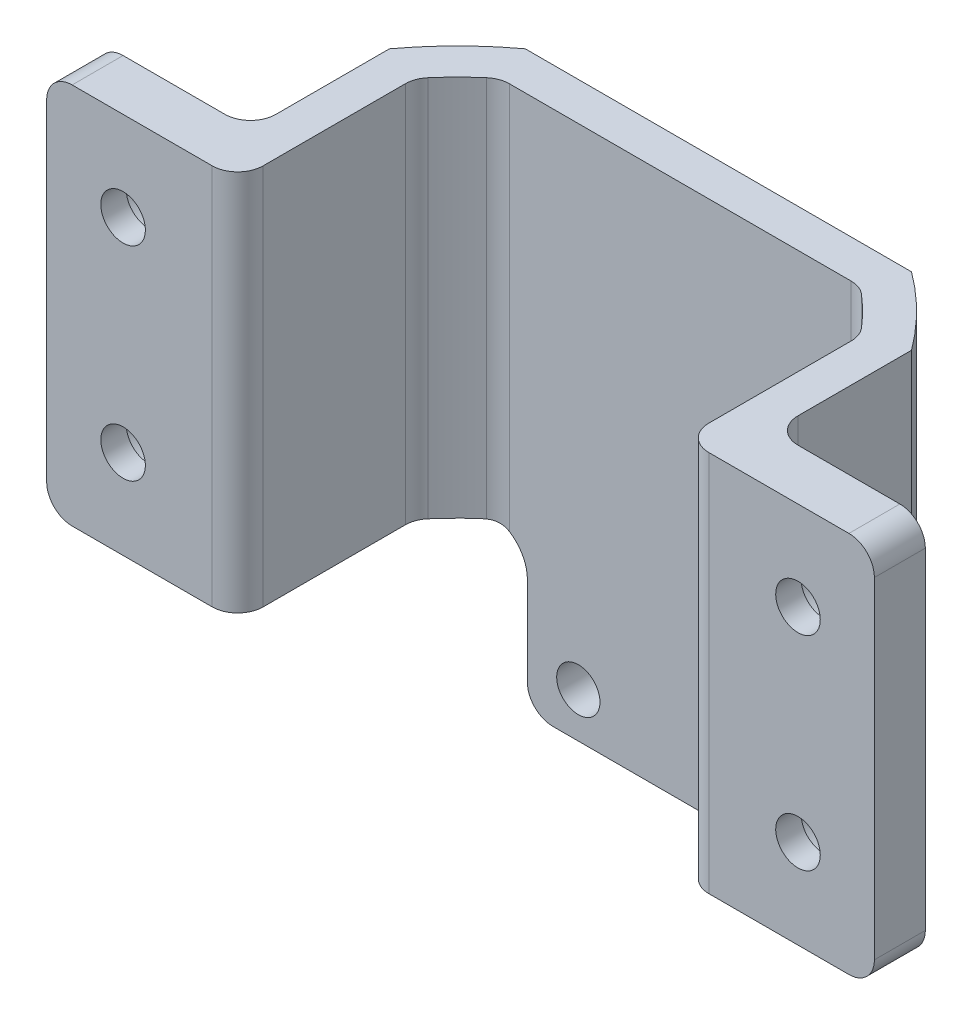
from build123d import *

# Parameters (mm, degrees)
EXTRUDE_1_DEPTH     = 30
FILLET_1_R          = 2
SKETCH_2_W          = 4
SKETCH_2_H          = 30
EXTRUDE_2_DEPTH     = 12
SKETCH_3_W          = 79.384571865
SKETCH_3_H          = 60.739492306
CUT_EXTRUDE_1_DEPTH = 30
SKETCH_4_R          = 1.75
CUT_EXTRUDE_2_DEPTH = 30
SKETCH_5_R          = 3
CUT_EXTRUDE_3_DEPTH = 2
FILLET_2_R          = 2
SKETCH_6_W          = 24
SKETCH_6_H          = 3
EXTRUDE_4_DEPTH     = 12
SKETCH_7_R          = 1.7
CUT_EXTRUDE_4_DEPTH = 12
FILLET_3_R          = 3
FILLET_4_R          = 2


with BuildPart() as part:
    # 草图1 → 凸台-拉伸1 (new body)
    with BuildSketch(Plane(origin=(0, 0, 0), x_dir=(1, 0, 0), z_dir=(0, 1, 0))):
        with BuildLine():
            Line((15.165750888, 20.5), (-15.165750888, 20.5))
            ThreePointArc((-15.165750888, 20.5), (-18.03122292, 18.03122292), (-20.5, 15.165750888))
            Line((-20.5, 15.165750888), (-20.5, -15.165750888))
            ThreePointArc((-20.5, -15.165750888), (-18.03122292, -18.03122292), (-15.165750888, -20.5))
            Line((-15.165750888, -20.5), (15.165750888, -20.5))
            ThreePointArc((15.165750888, -20.5), (18.03122292, -18.03122292), (20.5, -15.165750888))
            Line((20.5, -15.165750888), (20.5, 15.165750888))
            ThreePointArc((20.5, 15.165750888), (18.03122292, 18.03122292), (15.165750888, 20.5))
        make_face()
        with BuildLine():
            Line((-17.5, 14.142135624), (-17.5, -14.142135624))
            ThreePointArc((-17.5, -14.142135624), (-15.909902577, -15.909902577), (-14.142135624, -17.5))
            Line((-14.142135624, -17.5), (14.142135624, -17.5))
            ThreePointArc((14.142135624, -17.5), (15.909902577, -15.909902577), (17.5, -14.142135624))
            Line((17.5, -14.142135624), (17.5, 14.142135624))
            ThreePointArc((17.5, 14.142135624), (15.909902577, 15.909902577), (14.142135624, 17.5))
            Line((14.142135624, 17.5), (-14.142135624, 17.5))
            ThreePointArc((-14.142135624, 17.5), (-15.909902577, 15.909902577), (-17.5, 14.142135624))
        make_face(mode=Mode.SUBTRACT)
    extrude(amount=EXTRUDE_1_DEPTH)

    # 圆角1
    fillet_1_edges = [part.edges().sort_by_distance(p)[0] for p in [
        (-14.142135624, 15, -17.5),
        (-17.5, 15, -14.142135624),
        (-17.5, 15, 14.142135624),
        (-14.142135624, 15, 17.5),
        (14.142135624, 15, 17.5),
        (17.5, 15, 14.142135624),
        (17.5, 15, -14.142135624),
        (14.142135624, 15, -17.5),
    ]]
    fillet(fillet_1_edges, radius=FILLET_1_R)

    # 草图2 → 凸台-拉伸2 (add)
    with BuildSketch(Plane.ZY.offset(20.5)):
        with Locations((-2.25, 15)):
            Rectangle(SKETCH_2_W, SKETCH_2_H)
    extrude_2 = extrude(amount=EXTRUDE_2_DEPTH)

    # 草图3 → 切除-拉伸1 (cut)
    with BuildSketch(Plane.XY.offset(-0.25)):
        with Locations((-5.656839026, 19.40389916)):
            Rectangle(SKETCH_3_W, SKETCH_3_H)
    cut_extrude_1 = extrude(amount=CUT_EXTRUDE_1_DEPTH, mode=Mode.SUBTRACT)

    # 草图4 → 切除-拉伸2 (cut)
    with BuildSketch(Plane(origin=(0, 0, -4.25), x_dir=(-1, 0, 0), z_dir=(0, 0, -1))):
        with Locations(Location((26.5, 23, 0), (0, 0, 90))):
            Circle(SKETCH_4_R)
        with Locations(Location((26.5, 7, 0), (0, 0, 90))):
            Circle(SKETCH_4_R)
    cut_extrude_2 = extrude(amount=-CUT_EXTRUDE_2_DEPTH, mode=Mode.SUBTRACT)

    # 草图5 → 切除-拉伸3 (cut)
    with BuildSketch(Plane(origin=(0, 0, -4.25), x_dir=(-1, 0, 0), z_dir=(0, 0, -1))):
        with Locations(Location((26.5, 23, 0), (0, 0, 90))):
            Circle(SKETCH_5_R)
        with Locations(Location((26.5, 7, 0), (0, 0, 90))):
            Circle(SKETCH_5_R)
    cut_extrude_3 = extrude(amount=-CUT_EXTRUDE_3_DEPTH, mode=Mode.SUBTRACT)

    # 镜向1: 凸台-拉伸2, 切除-拉伸1, 切除-拉伸2, 切除-拉伸3 across plane
    add(extrude_2.mirror(Plane.ZY))
    add(cut_extrude_1.mirror(Plane.ZY), mode=Mode.SUBTRACT)
    add(cut_extrude_2.mirror(Plane.ZY), mode=Mode.SUBTRACT)
    add(cut_extrude_3.mirror(Plane.ZY), mode=Mode.SUBTRACT)

    # 圆角2
    fillet_2_edges = [part.edges().sort_by_distance(p)[0] for p in [
        (-20.5, 15, -4.25),
        (-32.5, 30, -2.25),
        (-32.5, 0, -2.25),
        (17.5, 15, -0.25),
        (-17.5, 15, -0.25),
        (32.5, 0, -2.25),
        (32.5, 30, -2.25),
        (20.5, 15, -4.25),
    ]]
    fillet(fillet_2_edges, radius=FILLET_2_R)

    # 草图6 → 凸台-拉伸4 (add)
    with BuildSketch(Plane(origin=(0, 0, 0), x_dir=(1, 0, 0), z_dir=(0, 1, 0))):
        with Locations((0, 19)):
            Rectangle(SKETCH_6_W, SKETCH_6_H)
    extrude(amount=-EXTRUDE_4_DEPTH)

    # 草图7 → 切除-拉伸4 (cut)
    with BuildSketch(Plane(origin=(0, 0, -20.5), x_dir=(-1, 0, 0), z_dir=(0, 0, -1))):
        with Locations((8, -8.5)):
            Circle(SKETCH_7_R)
        with Locations(Location((-8, -8.5, 0), (0, 0, 180))):
            Circle(SKETCH_7_R)
    extrude(amount=-CUT_EXTRUDE_4_DEPTH, mode=Mode.SUBTRACT)

    # 圆角3
    fillet_3_edges = [part.edges().sort_by_distance(p)[0] for p in [
        (-12, 0, -19),
        (12, 0, -19),
    ]]
    fillet(fillet_3_edges, radius=FILLET_3_R)

    # 圆角4
    fillet_4_edges = [part.edges().sort_by_distance(p)[0] for p in [
        (-12, -12, -19),
        (12, -12, -19),
    ]]
    fillet(fillet_4_edges, radius=FILLET_4_R)


solid = part.part
